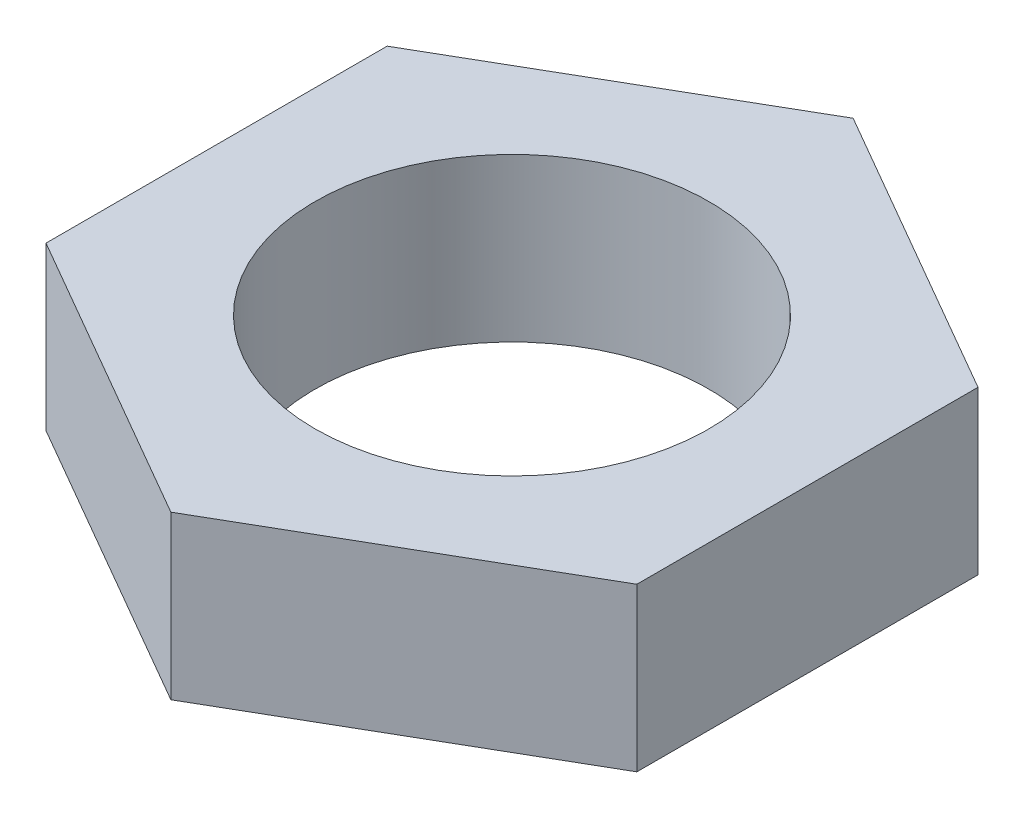
from build123d import *

# Parameters (mm, degrees)
CROQUIS1_R              = 4
SALIENTE_EXTRUIR1_DEPTH = 3.3


with BuildPart() as part:
    # Croquis1 → Saliente-Extruir1 (new body)
    with BuildSketch(Plane(origin=(0, 0, 0), x_dir=(1, 0, 0), z_dir=(0, 1, 0))):
        Polygon((6, -3.464101615), (6, 3.464101615), (0, 6.92820323), (-6, 3.464101615), (-6, -3.464101615), (0, -6.92820323), align=None)
        with Locations(Location((0, 0, 0), (0, 0, 270))):
            Circle(CROQUIS1_R, mode=Mode.SUBTRACT)
    extrude(amount=SALIENTE_EXTRUIR1_DEPTH)


solid = part.part
